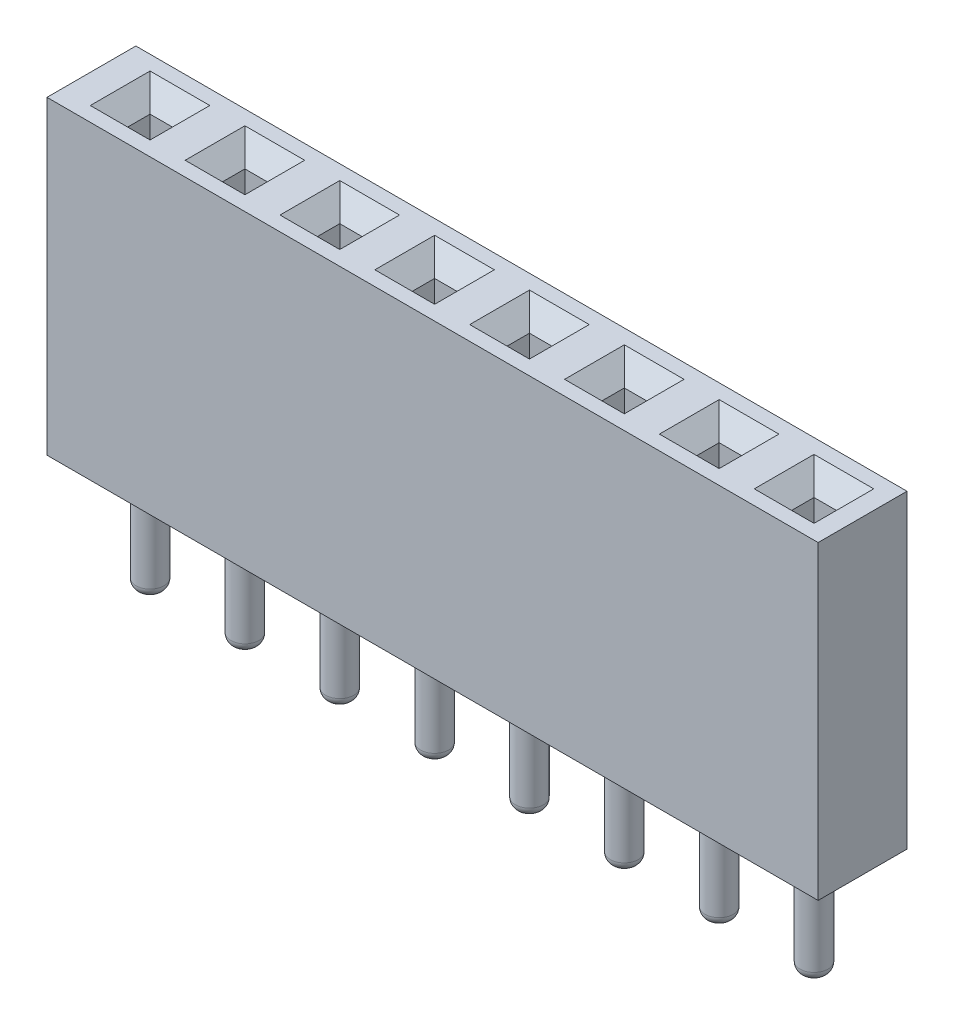
from build123d import *

# Parameters (mm, degrees)
SKETCH1_W                  = 20.65
SKETCH1_H                  = 2.38
BOSS_EXTRUDE1_DEPTH        = 8.3
SKETCH2_W                  = 0.6
SKETCH2_H                  = 0.6
CUT_EXTRUDE1_DEPTH         = 8.3
CHAMFER1_SIZE              = 0.5
SKETCH3_R                  = 0.375
BOSS_EXTRUDE2_DEPTH        = 2.9
BOSS_EXTRUDE3_START        = 1
SKETCH4_W                  = 0.6
SKETCH4_H                  = 0.6
BOSS_EXTRUDE3_DEPTH        = 1
FILLET1_R                  = 0.25
LPATTERN1_COUNT            = 8
LPATTERN1_PITCH            = 2.54
CHAMFER1_OF_LPATTERN1_SIZE = 0.5
FILLET1_OF_LPATTERN1_R     = 0.25


with BuildPart() as part:
    # Sketch1 → Boss-Extrude1 (new body)
    with BuildSketch(Plane(origin=(0, 0, 0), x_dir=(1, 0, 0), z_dir=(0, 1, 0))):
        Rectangle(SKETCH1_W, SKETCH1_H)
    extrude(amount=BOSS_EXTRUDE1_DEPTH)

    # Sketch2 → Cut-Extrude1 (cut)
    with BuildSketch(Plane(origin=(0, 8.3, 0), x_dir=(1, 0, 0), z_dir=(0, 1, 0))):
        with Locations((-8.755, 0)):
            Rectangle(SKETCH2_W, SKETCH2_H)
    cut_extrude1 = extrude(amount=-CUT_EXTRUDE1_DEPTH, mode=Mode.SUBTRACT)

    # Chamfer1
    chamfer1_edges = [part.edges().sort_by_distance(p)[0] for p in [
        (-8.455, 8.3, 0),
        (-8.755, 8.3, -0.3),
        (-9.055, 8.3, 0),
        (-8.755, 8.3, 0.3),
    ]]
    chamfer(chamfer1_edges, length=CHAMFER1_SIZE)

    # Sketch3 → Boss-Extrude2 (add)
    with BuildSketch(Plane.XZ):
        with Locations(Location((-8.755, 0, 0), (0, 0, 126.869897646))):
            Circle(SKETCH3_R)
    boss_extrude2 = extrude(amount=BOSS_EXTRUDE2_DEPTH)

    # Sketch4 → Boss-Extrude3 (add)
    with BuildSketch(Plane(origin=(0, 0, 0), x_dir=(1, 0, 0), z_dir=(0, 1, 0)).offset(BOSS_EXTRUDE3_START)):
        with BuildLine():
            Line((-8.455, -0.225), (-8.455, 0.225))
            ThreePointArc((-8.455, 0.225), (-8.489834957, 0.265165043), (-8.53, 0.3))
            Line((-8.53, 0.3), (-8.98, 0.3))
            ThreePointArc((-8.98, 0.3), (-9.020165043, 0.265165043), (-9.055, 0.225))
            Line((-9.055, 0.225), (-9.055, -0.225))
            ThreePointArc((-9.055, -0.225), (-9.020165043, -0.265165043), (-8.98, -0.3))
            Line((-8.98, -0.3), (-8.53, -0.3))
            ThreePointArc((-8.53, -0.3), (-8.489834957, -0.265165043), (-8.455, -0.225))
        make_face()
        with Locations((-8.755, 0)):
            Rectangle(SKETCH4_W, SKETCH4_H)
    boss_extrude3 = extrude(amount=-BOSS_EXTRUDE3_DEPTH)

    # Fillet1
    fillet1_edges = [part.edges().sort_by_distance(p)[0] for p in [
        (-8.53, -2.9, -0.3),
    ]]
    fillet(fillet1_edges, radius=FILLET1_R)

    # LPattern1: Cut-Extrude1, Boss-Extrude2, Boss-Extrude3 ×8
    with Locations(*[(i * LPATTERN1_PITCH, 0, 0) for i in range(1, LPATTERN1_COUNT)]):
        add(cut_extrude1, mode=Mode.SUBTRACT)
        add(boss_extrude2)
        add(boss_extrude3)

    # Chamfer1 of LPattern1
    chamfer1_of_lpattern1_edges = [part.edges().sort_by_distance(p)[0] for p in [
        (-5.915, 8.3, 0),
        (-6.215, 8.3, -0.3),
        (-6.515, 8.3, 0),
        (-6.215, 8.3, 0.3),
        (-3.375, 8.3, 0),
        (-3.675, 8.3, -0.3),
        (-3.975, 8.3, 0),
        (-3.675, 8.3, 0.3),
        (-0.835, 8.3, 0),
        (-1.135, 8.3, -0.3),
        (-1.435, 8.3, 0),
        (-1.135, 8.3, 0.3),
        (1.705, 8.3, 0),
        (1.405, 8.3, -0.3),
        (1.105, 8.3, 0),
        (1.405, 8.3, 0.3),
        (4.245, 8.3, 0),
        (3.945, 8.3, -0.3),
        (3.645, 8.3, 0),
        (3.945, 8.3, 0.3),
        (6.785, 8.3, 0),
        (6.485, 8.3, -0.3),
        (6.185, 8.3, 0),
        (6.485, 8.3, 0.3),
        (9.325, 8.3, 0),
        (9.025, 8.3, -0.3),
        (8.725, 8.3, 0),
        (9.025, 8.3, 0.3),
    ]]
    chamfer(chamfer1_of_lpattern1_edges, length=CHAMFER1_OF_LPATTERN1_SIZE)

    # Fillet1 of LPattern1
    fillet1_of_lpattern1_edges = [part.edges().sort_by_distance(p)[0] for p in [
        (-5.99, -2.9, -0.3),
        (-3.45, -2.9, -0.3),
        (-0.91, -2.9, -0.3),
        (1.63, -2.9, -0.3),
        (4.17, -2.9, -0.3),
        (6.71, -2.9, -0.3),
        (9.25, -2.9, -0.3),
    ]]
    fillet(fillet1_of_lpattern1_edges, radius=FILLET1_OF_LPATTERN1_R)


solid = part.part
